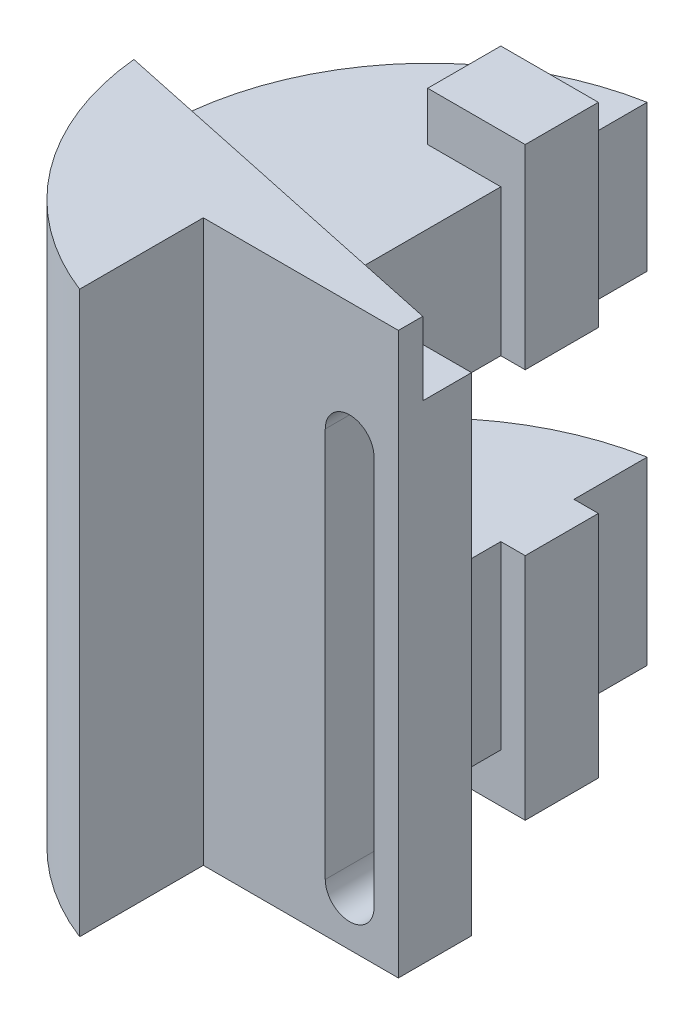
from build123d import *

# Parameters (mm, degrees)
BOSS_EXTRUDE1_DEPTH = 115
CUT_EXTRUDE1_START  = -15
CUT_EXTRUDE1_DEPTH  = 15
BOSS_EXTRUDE2_START = -110
SKETCH3_W           = 20
SKETCH3_H           = 15
BOSS_EXTRUDE2_DEPTH = 120
SKETCH5_W           = 40
SKETCH5_H           = 33
CUT_EXTRUDE2_DEPTH  = 165.585219816
CUT_EXTRUDE3_DEPTH  = 139.495487291


with BuildPart() as part:
    # Sketch1 → Boss-Extrude1 (new body)
    with BuildSketch(Plane(origin=(0, 0, 0), x_dir=(1, 0, 0), z_dir=(0, 1, 0))):
        with BuildLine():
            Line((0, 0), (0, 25.362796982))
            Line((0, 25.362796982), (40, 25.362796982))
            Line((40, 25.362796982), (40, 40.362796982))
            Line((40, 40.362796982), (10, 40.362796982))
            Line((10, 40.362796982), (10, 106.362796982))
            ThreePointArc((10, 106.362796982), (-35.256322222, 56.96621079), (0, 0))
        make_face()
    extrude(amount=BOSS_EXTRUDE1_DEPTH)

    # Sketch2 → Cut-Extrude1 (cut)
    with BuildSketch(Plane(origin=(0, 115, 0), x_dir=(1, 0, 0), z_dir=(0, 1, 0)).offset(CUT_EXTRUDE1_START)):
        with BuildLine():
            Line((40, 30.362796982), (-35.235044142, 46.354499282))
            ThreePointArc((-35.235044142, 46.354499282), (-24.318751046, 85.179188449), (10, 106.362796982))
            Line((10, 106.362796982), (10, 40.362796982))
            Line((10, 40.362796982), (40, 40.362796982))
            Line((40, 40.362796982), (40, 30.362796982))
        make_face()
    extrude(amount=CUT_EXTRUDE1_DEPTH, mode=Mode.SUBTRACT)

    # Sketch3 → Boss-Extrude2 (add)
    with BuildSketch(Plane(origin=(0, 100, 0), x_dir=(1, 0, 0), z_dir=(0, 1, 0)).offset(BOSS_EXTRUDE2_START)):
        with Locations((5, 83.862796982)):
            Rectangle(SKETCH3_W, SKETCH3_H)
    extrude(amount=BOSS_EXTRUDE2_DEPTH)

    # Sketch5 → Cut-Extrude2 (cut, through all)
    with BuildSketch(Plane(origin=(15, 0, 0), x_dir=(0, 0, -1), z_dir=(1, 0, 0))):
        with Locations((86.362796982, 53.5)):
            Rectangle(SKETCH5_W, SKETCH5_H)
    extrude(amount=-CUT_EXTRUDE2_DEPTH, mode=Mode.SUBTRACT)

    # Sketch6 → Cut-Extrude3 (cut, through all)
    with BuildSketch(Plane(origin=(0, 0, -40.362796982), x_dir=(-1, 0, 0), z_dir=(0, 0, -1))):
        with BuildLine():
            Line((-25, 90), (-25, 10))
            ThreePointArc((-25, 10), (-30, 5), (-35, 10))
            Line((-35, 10), (-35, 90))
            ThreePointArc((-35, 90), (-30, 95), (-25, 90))
        make_face()
    extrude(amount=-CUT_EXTRUDE3_DEPTH, mode=Mode.SUBTRACT)


solid = part.part
